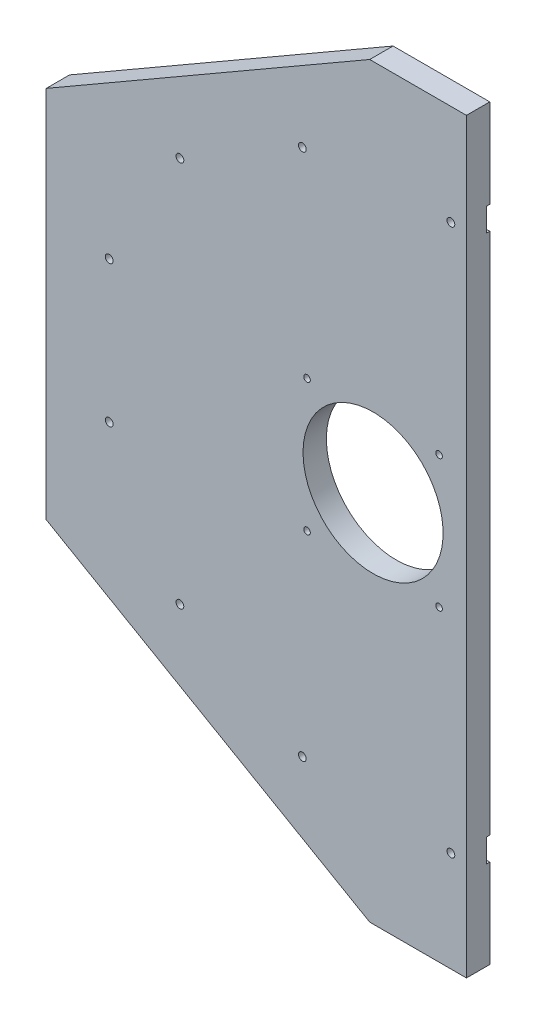
from build123d import *

# Parameters (mm, degrees)
EXTRUDE_1_DEPTH          = 15
CUT_EXTRUDE_2_DEPTH      = 2
SKETCH_2_R               = 45
CUT_EXTRUDE_3_DEPTH      = 279.25348156
CUT_EXTRUDE_4_DEPTH      = 279.25348156
CUT_EXTRUDE_4_DEPTH_BACK = 279.25348156
HOLE_WIZARD_M5_1_D       = 4.2
HOLE_WIZARD_M6_1_D       = 5


with BuildPart() as part:
    # 草图1 → 凸台-拉伸1 (new body)
    with BuildSketch(Plane.XY):
        with BuildLine():
            Line((140, 183), (140, 240))
            Line((140, 240), (-140, 240))
            Line((-140, 240), (-140, -240))
            Line((-140, -240), (140, -240))
            Line((140, -240), (140, -183))
            Line((140, -183), (80, -183))
            ThreePointArc((80, -183), (-103, 0), (80, 183))
            Line((80, 183), (140, 183))
        make_face()
        with BuildLine():
            Line((140, -168), (140, 168))
            Line((140, 168), (80, 168))
            ThreePointArc((80, 168), (-88, 0), (80, -168))
            Line((80, -168), (140, -168))
        make_face()
        with BuildLine():
            Line((140, 168), (140, 183))
            Line((140, 183), (80, 183))
            ThreePointArc((80, 183), (-103, 0), (80, -183))
            Line((80, -183), (140, -183))
            Line((140, -183), (140, -168))
            Line((140, -168), (80, -168))
            ThreePointArc((80, -168), (-88, 0), (80, 168))
            Line((80, 168), (140, 168))
        make_face()
    extrude(amount=EXTRUDE_1_DEPTH)

    # 草图1<4> → 切除-拉伸2 (cut)
    with BuildSketch(Plane.XY):
        with BuildLine():
            Line((140, 168), (140, 183))
            Line((140, 183), (80, 183))
            ThreePointArc((80, 183), (-103, 0), (80, -183))
            Line((80, -183), (140, -183))
            Line((140, -183), (140, -168))
            Line((140, -168), (80, -168))
            ThreePointArc((80, -168), (-88, 0), (80, 168))
            Line((80, 168), (140, 168))
        make_face()
    extrude(amount=CUT_EXTRUDE_2_DEPTH, mode=Mode.SUBTRACT)

    # 草图2 → 切除-拉伸3 (cut, through all)
    with BuildSketch(Plane(origin=(0, 0, 0), x_dir=(-1, 0, 0), z_dir=(0, 0, -1))):
        with Locations((-80, 0)):
            Circle(SKETCH_2_R)
    extrude(amount=-CUT_EXTRUDE_3_DEPTH, mode=Mode.SUBTRACT)

    # 草图3 → 切除-拉伸4 (cut, two sides: drawn at the far end of the back side and taken through both)
    with BuildSketch(Plane(origin=(0, 0, 0), x_dir=(-1, 0, 0), z_dir=(0, 0, -1)).offset(-CUT_EXTRUDE_4_DEPTH_BACK)):
        Polygon((140, 240), (-77.846096908, 240), (130, 120), (130, -120), (-77.846096908, -240), (140, -240), align=None)
    extrude(amount=CUT_EXTRUDE_4_DEPTH + CUT_EXTRUDE_4_DEPTH_BACK, mode=Mode.SUBTRACT)

    # M5 螺纹孔1 (through all)
    with Locations(Plane(origin=(0, 0, 0), x_dir=(-1, 0, 0), z_dir=(0, 0, -1))):
        with Locations((-122.426406871, 42.426406871), (-37.573593129, 42.426406871), (-37.573593129, -42.426406871), (-122.426406871, -42.426406871)):
            Hole(HOLE_WIZARD_M5_1_D / 2)

    # M6 螺纹孔1 (through all)
    with Locations(Plane(origin=(130, 175.5, 2), x_dir=(-1, 0, 0), z_dir=(0, 0, -1))):
        with Locations((0, 0), (95.422742415, -5.980017486), (174.097240098, -51.402759902), (219.519982514, -130.077257585), (219.519982514, -220.922742415), (174.097240098, -299.597240098), (95.422742415, -345.019982514), (0, -351)):
            Hole(HOLE_WIZARD_M6_1_D / 2)


solid = part.part
